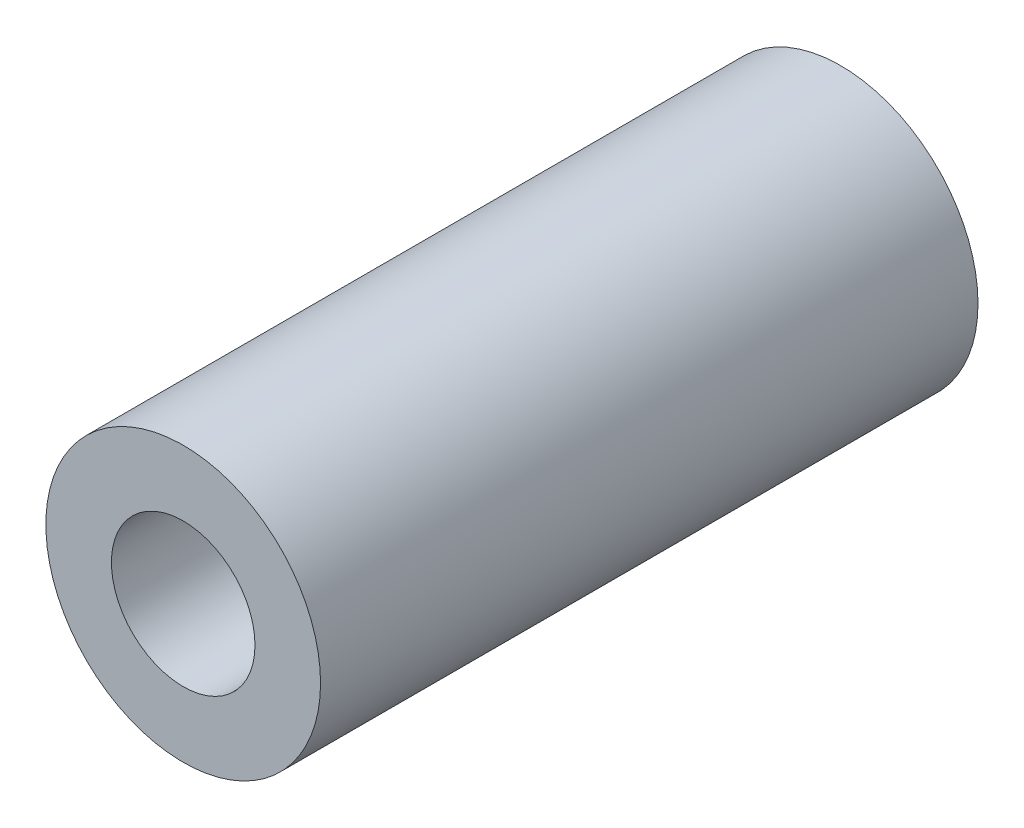
from build123d import *

# Parameters (mm, degrees)
SKETCH1_R           = 4.7625
SKETCH1_R_2         = 2.4892
BOSS_EXTRUDE1_DEPTH = 11.39825


with BuildPart() as part:
    # Sketch1 → Boss-Extrude1 (new, symmetric)
    with BuildSketch(Plane.XY):
        Circle(SKETCH1_R)
        Circle(SKETCH1_R_2, mode=Mode.SUBTRACT)
    extrude(amount=BOSS_EXTRUDE1_DEPTH, both=True)


solid = part.part
